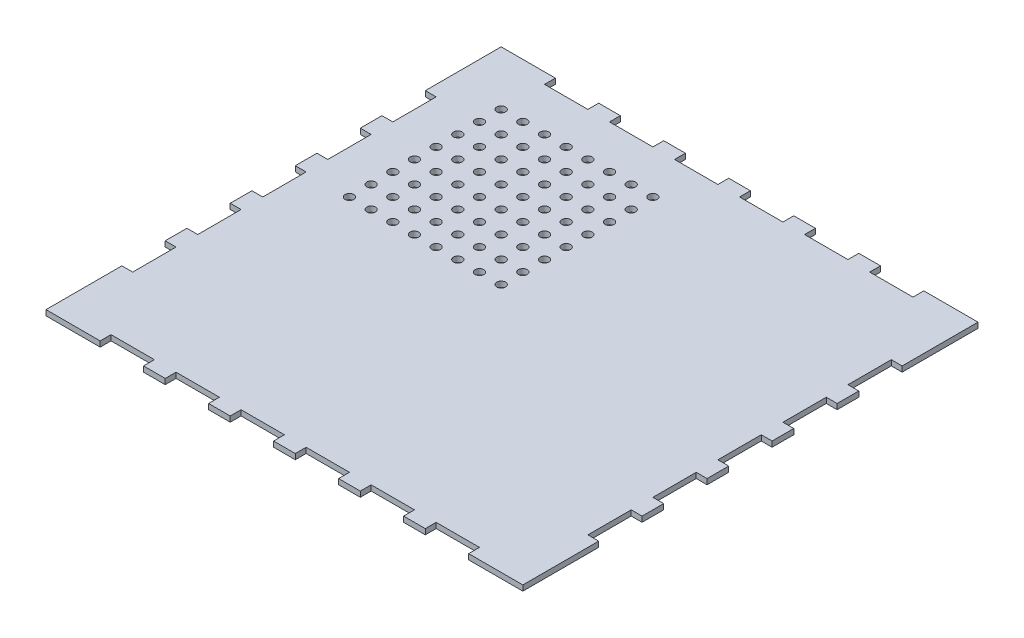
from build123d import *

# Parameters (mm, degrees)
SKETCH7_W           = 266.7
SKETCH7_H           = 254
SKETCH7_R           = 2.54
BOSS_EXTRUDE4_DEPTH = 3.175
SKETCH8_W           = 12.7
SKETCH8_H           = 6.35
SKETCH8_W_2         = 6.35
SKETCH8_H_2         = 12.7
BOSS_EXTRUDE5_DEPTH = 3.175
SKETCH9_W           = 19.05
SKETCH9_H           = 31.75
BOSS_EXTRUDE6_DEPTH = 3.175


with BuildPart() as part:
    # Sketch7 → Boss-Extrude4 (new body)
    with BuildSketch(Plane(origin=(0, 0, 0), x_dir=(1, 0, 0), z_dir=(0, 1, 0))):
        Rectangle(SKETCH7_W, SKETCH7_H)
        with Locations(Location((-107.95, 101.6, 0), (0, 0, 270))):
            Circle(SKETCH7_R, mode=Mode.SUBTRACT)
        with Locations(Location((-95.25, 101.6, 0), (0, 0, 270))):
            Circle(SKETCH7_R, mode=Mode.SUBTRACT)
        with Locations(Location((-82.55, 101.6, 0), (0, 0, 270))):
            Circle(SKETCH7_R, mode=Mode.SUBTRACT)
        with Locations(Location((-69.85, 101.6, 0), (0, 0, 270))):
            Circle(SKETCH7_R, mode=Mode.SUBTRACT)
        with Locations(Location((-57.15, 101.6, 0), (0, 0, 270))):
            Circle(SKETCH7_R, mode=Mode.SUBTRACT)
        with Locations(Location((-44.45, 101.6, 0), (0, 0, 270))):
            Circle(SKETCH7_R, mode=Mode.SUBTRACT)
        with Locations(Location((-31.75, 101.6, 0), (0, 0, 270))):
            Circle(SKETCH7_R, mode=Mode.SUBTRACT)
        with Locations(Location((-19.05, 101.6, 0), (0, 0, 270))):
            Circle(SKETCH7_R, mode=Mode.SUBTRACT)
        with Locations(Location((-95.25, 88.9, 0), (0, 0, 270))):
            Circle(SKETCH7_R, mode=Mode.SUBTRACT)
        with Locations(Location((-82.55, 88.9, 0), (0, 0, 270))):
            Circle(SKETCH7_R, mode=Mode.SUBTRACT)
        with Locations(Location((-69.85, 88.9, 0), (0, 0, 270))):
            Circle(SKETCH7_R, mode=Mode.SUBTRACT)
        with Locations(Location((-57.15, 88.9, 0), (0, 0, 270))):
            Circle(SKETCH7_R, mode=Mode.SUBTRACT)
        with Locations(Location((-44.45, 88.9, 0), (0, 0, 270))):
            Circle(SKETCH7_R, mode=Mode.SUBTRACT)
        with Locations(Location((-31.75, 88.9, 0), (0, 0, 270))):
            Circle(SKETCH7_R, mode=Mode.SUBTRACT)
        with Locations(Location((-19.05, 88.9, 0), (0, 0, 270))):
            Circle(SKETCH7_R, mode=Mode.SUBTRACT)
        with Locations(Location((-95.25, 76.2, 0), (0, 0, 270))):
            Circle(SKETCH7_R, mode=Mode.SUBTRACT)
        with Locations(Location((-82.55, 76.2, 0), (0, 0, 270))):
            Circle(SKETCH7_R, mode=Mode.SUBTRACT)
        with Locations(Location((-69.85, 76.2, 0), (0, 0, 270))):
            Circle(SKETCH7_R, mode=Mode.SUBTRACT)
        with Locations(Location((-57.15, 76.2, 0), (0, 0, 270))):
            Circle(SKETCH7_R, mode=Mode.SUBTRACT)
        with Locations(Location((-44.45, 76.2, 0), (0, 0, 270))):
            Circle(SKETCH7_R, mode=Mode.SUBTRACT)
        with Locations(Location((-31.75, 76.2, 0), (0, 0, 270))):
            Circle(SKETCH7_R, mode=Mode.SUBTRACT)
        with Locations(Location((-19.05, 76.2, 0), (0, 0, 270))):
            Circle(SKETCH7_R, mode=Mode.SUBTRACT)
        with Locations(Location((-95.25, 63.5, 0), (0, 0, 270))):
            Circle(SKETCH7_R, mode=Mode.SUBTRACT)
        with Locations(Location((-82.55, 63.5, 0), (0, 0, 270))):
            Circle(SKETCH7_R, mode=Mode.SUBTRACT)
        with Locations(Location((-69.85, 63.5, 0), (0, 0, 270))):
            Circle(SKETCH7_R, mode=Mode.SUBTRACT)
        with Locations(Location((-57.15, 63.5, 0), (0, 0, 270))):
            Circle(SKETCH7_R, mode=Mode.SUBTRACT)
        with Locations(Location((-44.45, 63.5, 0), (0, 0, 270))):
            Circle(SKETCH7_R, mode=Mode.SUBTRACT)
        with Locations(Location((-31.75, 63.5, 0), (0, 0, 270))):
            Circle(SKETCH7_R, mode=Mode.SUBTRACT)
        with Locations(Location((-19.05, 63.5, 0), (0, 0, 270))):
            Circle(SKETCH7_R, mode=Mode.SUBTRACT)
        with Locations(Location((-95.25, 50.8, 0), (0, 0, 270))):
            Circle(SKETCH7_R, mode=Mode.SUBTRACT)
        with Locations(Location((-82.55, 50.8, 0), (0, 0, 270))):
            Circle(SKETCH7_R, mode=Mode.SUBTRACT)
        with Locations(Location((-69.85, 50.8, 0), (0, 0, 270))):
            Circle(SKETCH7_R, mode=Mode.SUBTRACT)
        with Locations(Location((-57.15, 50.8, 0), (0, 0, 270))):
            Circle(SKETCH7_R, mode=Mode.SUBTRACT)
        with Locations(Location((-44.45, 50.8, 0), (0, 0, 270))):
            Circle(SKETCH7_R, mode=Mode.SUBTRACT)
        with Locations(Location((-31.75, 50.8, 0), (0, 0, 270))):
            Circle(SKETCH7_R, mode=Mode.SUBTRACT)
        with Locations(Location((-19.05, 50.8, 0), (0, 0, 270))):
            Circle(SKETCH7_R, mode=Mode.SUBTRACT)
        with Locations(Location((-95.25, 38.1, 0), (0, 0, 270))):
            Circle(SKETCH7_R, mode=Mode.SUBTRACT)
        with Locations(Location((-82.55, 38.1, 0), (0, 0, 270))):
            Circle(SKETCH7_R, mode=Mode.SUBTRACT)
        with Locations(Location((-69.85, 38.1, 0), (0, 0, 270))):
            Circle(SKETCH7_R, mode=Mode.SUBTRACT)
        with Locations(Location((-57.15, 38.1, 0), (0, 0, 270))):
            Circle(SKETCH7_R, mode=Mode.SUBTRACT)
        with Locations(Location((-44.45, 38.1, 0), (0, 0, 270))):
            Circle(SKETCH7_R, mode=Mode.SUBTRACT)
        with Locations(Location((-31.75, 38.1, 0), (0, 0, 270))):
            Circle(SKETCH7_R, mode=Mode.SUBTRACT)
        with Locations(Location((-19.05, 38.1, 0), (0, 0, 270))):
            Circle(SKETCH7_R, mode=Mode.SUBTRACT)
        with Locations(Location((-95.25, 25.4, 0), (0, 0, 270))):
            Circle(SKETCH7_R, mode=Mode.SUBTRACT)
        with Locations(Location((-82.55, 25.4, 0), (0, 0, 270))):
            Circle(SKETCH7_R, mode=Mode.SUBTRACT)
        with Locations(Location((-69.85, 25.4, 0), (0, 0, 270))):
            Circle(SKETCH7_R, mode=Mode.SUBTRACT)
        with Locations(Location((-57.15, 25.4, 0), (0, 0, 270))):
            Circle(SKETCH7_R, mode=Mode.SUBTRACT)
        with Locations(Location((-44.45, 25.4, 0), (0, 0, 270))):
            Circle(SKETCH7_R, mode=Mode.SUBTRACT)
        with Locations(Location((-31.75, 25.4, 0), (0, 0, 270))):
            Circle(SKETCH7_R, mode=Mode.SUBTRACT)
        with Locations(Location((-19.05, 25.4, 0), (0, 0, 270))):
            Circle(SKETCH7_R, mode=Mode.SUBTRACT)
        with Locations(Location((-95.25, 12.7, 0), (0, 0, 270))):
            Circle(SKETCH7_R, mode=Mode.SUBTRACT)
        with Locations(Location((-82.55, 12.7, 0), (0, 0, 270))):
            Circle(SKETCH7_R, mode=Mode.SUBTRACT)
        with Locations(Location((-69.85, 12.7, 0), (0, 0, 270))):
            Circle(SKETCH7_R, mode=Mode.SUBTRACT)
        with Locations(Location((-57.15, 12.7, 0), (0, 0, 270))):
            Circle(SKETCH7_R, mode=Mode.SUBTRACT)
        with Locations(Location((-44.45, 12.7, 0), (0, 0, 270))):
            Circle(SKETCH7_R, mode=Mode.SUBTRACT)
        with Locations(Location((-31.75, 12.7, 0), (0, 0, 270))):
            Circle(SKETCH7_R, mode=Mode.SUBTRACT)
        with Locations(Location((-19.05, 12.7, 0), (0, 0, 270))):
            Circle(SKETCH7_R, mode=Mode.SUBTRACT)
        with Locations(Location((-107.95, 88.9, 0), (0, 0, 270))):
            Circle(SKETCH7_R, mode=Mode.SUBTRACT)
        with Locations(Location((-107.95, 76.2, 0), (0, 0, 270))):
            Circle(SKETCH7_R, mode=Mode.SUBTRACT)
        with Locations(Location((-107.95, 63.5, 0), (0, 0, 270))):
            Circle(SKETCH7_R, mode=Mode.SUBTRACT)
        with Locations(Location((-107.95, 50.8, 0), (0, 0, 270))):
            Circle(SKETCH7_R, mode=Mode.SUBTRACT)
        with Locations(Location((-107.95, 38.1, 0), (0, 0, 270))):
            Circle(SKETCH7_R, mode=Mode.SUBTRACT)
        with Locations(Location((-107.95, 25.4, 0), (0, 0, 270))):
            Circle(SKETCH7_R, mode=Mode.SUBTRACT)
        with Locations(Location((-107.95, 12.7, 0), (0, 0, 270))):
            Circle(SKETCH7_R, mode=Mode.SUBTRACT)
    extrude(amount=BOSS_EXTRUDE4_DEPTH)

    # Sketch8 → Boss-Extrude5 (add)
    with BuildSketch(Plane(origin=(0, 0, 0), x_dir=(1, 0, 0), z_dir=(0, 1, 0))):
        with Locations((-114.3, 130.175)):
            Rectangle(SKETCH8_W, SKETCH8_H)
        with Locations((-76.2, 130.175)):
            Rectangle(SKETCH8_W, SKETCH8_H)
        with Locations((-38.1, 130.175)):
            Rectangle(SKETCH8_W, SKETCH8_H)
        with Locations((0, 130.175)):
            Rectangle(SKETCH8_W, SKETCH8_H)
        with Locations((38.1, 130.175)):
            Rectangle(SKETCH8_W, SKETCH8_H)
        with Locations((76.2, 130.175)):
            Rectangle(SKETCH8_W, SKETCH8_H)
        with Locations((114.3, 130.175)):
            Rectangle(SKETCH8_W, SKETCH8_H)
        with Locations((-114.3, -130.175)):
            Rectangle(SKETCH8_W, SKETCH8_H)
        with Locations((-76.2, -130.175)):
            Rectangle(SKETCH8_W, SKETCH8_H)
        with Locations((-38.1, -130.175)):
            Rectangle(SKETCH8_W, SKETCH8_H)
        with Locations((0, -130.175)):
            Rectangle(SKETCH8_W, SKETCH8_H)
        with Locations((38.1, -130.175)):
            Rectangle(SKETCH8_W, SKETCH8_H)
        with Locations((76.2, -130.175)):
            Rectangle(SKETCH8_W, SKETCH8_H)
        with Locations((114.3, -130.175)):
            Rectangle(SKETCH8_W, SKETCH8_H)
        with Locations((-136.525, 95.25)):
            Rectangle(SKETCH8_W_2, SKETCH8_H_2)
        with Locations((-136.525, 57.15)):
            Rectangle(SKETCH8_W_2, SKETCH8_H_2)
        with Locations((-136.525, 19.05)):
            Rectangle(SKETCH8_W_2, SKETCH8_H_2)
        with Locations((-136.525, -19.05)):
            Rectangle(SKETCH8_W_2, SKETCH8_H_2)
        with Locations((-136.525, -57.15)):
            Rectangle(SKETCH8_W_2, SKETCH8_H_2)
        with Locations((-136.525, -95.25)):
            Rectangle(SKETCH8_W_2, SKETCH8_H_2)
        with Locations((136.525, 95.25)):
            Rectangle(SKETCH8_W_2, SKETCH8_H_2)
        with Locations((136.525, 57.15)):
            Rectangle(SKETCH8_W_2, SKETCH8_H_2)
        with Locations((136.525, 19.05)):
            Rectangle(SKETCH8_W_2, SKETCH8_H_2)
        with Locations((136.525, -19.05)):
            Rectangle(SKETCH8_W_2, SKETCH8_H_2)
        with Locations((136.525, -57.15)):
            Rectangle(SKETCH8_W_2, SKETCH8_H_2)
        with Locations((136.525, -95.25)):
            Rectangle(SKETCH8_W_2, SKETCH8_H_2)
    extrude(amount=BOSS_EXTRUDE5_DEPTH)

    # Sketch9 → Boss-Extrude6 (add)
    with BuildSketch(Plane(origin=(0, 0, 0), x_dir=(1, 0, 0), z_dir=(0, 1, 0))):
        with Locations((-130.175, 117.475)):
            Rectangle(SKETCH9_W, SKETCH9_H)
        with Locations((130.175, 117.475)):
            Rectangle(SKETCH9_W, SKETCH9_H)
        with Locations((130.175, -117.475)):
            Rectangle(SKETCH9_W, SKETCH9_H)
        with Locations((-130.175, -117.475)):
            Rectangle(SKETCH9_W, SKETCH9_H)
    extrude(amount=BOSS_EXTRUDE6_DEPTH)


solid = part.part
